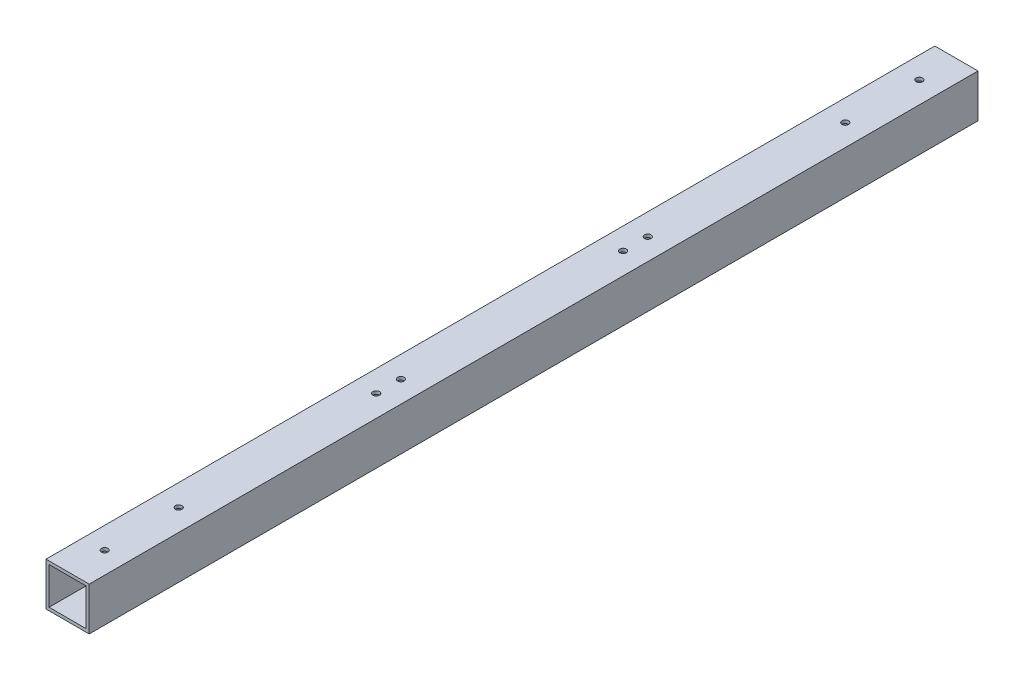
from build123d import *

# Parameters (mm, degrees)
SKETCH1_W                        = 44.45
SKETCH1_H                        = 44.45
SKETCH1_W_2                      = 38.1
SKETCH1_H_2                      = 38.1
BOSS_EXTRUDE1_DEPTH              = 914.4
F_17_64_0_26563_DIAMETER_HOLE1_D = 6.747002


with BuildPart() as part:
    # Sketch1 → Boss-Extrude1 (new body)
    with BuildSketch(Plane.XY):
        Rectangle(SKETCH1_W, SKETCH1_H)
        Rectangle(SKETCH1_W_2, SKETCH1_H_2, mode=Mode.SUBTRACT)
    extrude(amount=BOSS_EXTRUDE1_DEPTH)

    # 17/64 (0.26563) Diameter Hole1 (through all)
    with Locations(Plane(origin=(0, 22.225, 0), x_dir=(1, 0, 0), z_dir=(0, 1, 0))):
        with Locations((0, -38.1), (0, -876.3), (0, -317.5), (0, -596.9), (0, -114.3), (0, -342.9), (0, -571.5), (0, -800.1)):
            Hole(F_17_64_0_26563_DIAMETER_HOLE1_D / 2)


solid = part.part
